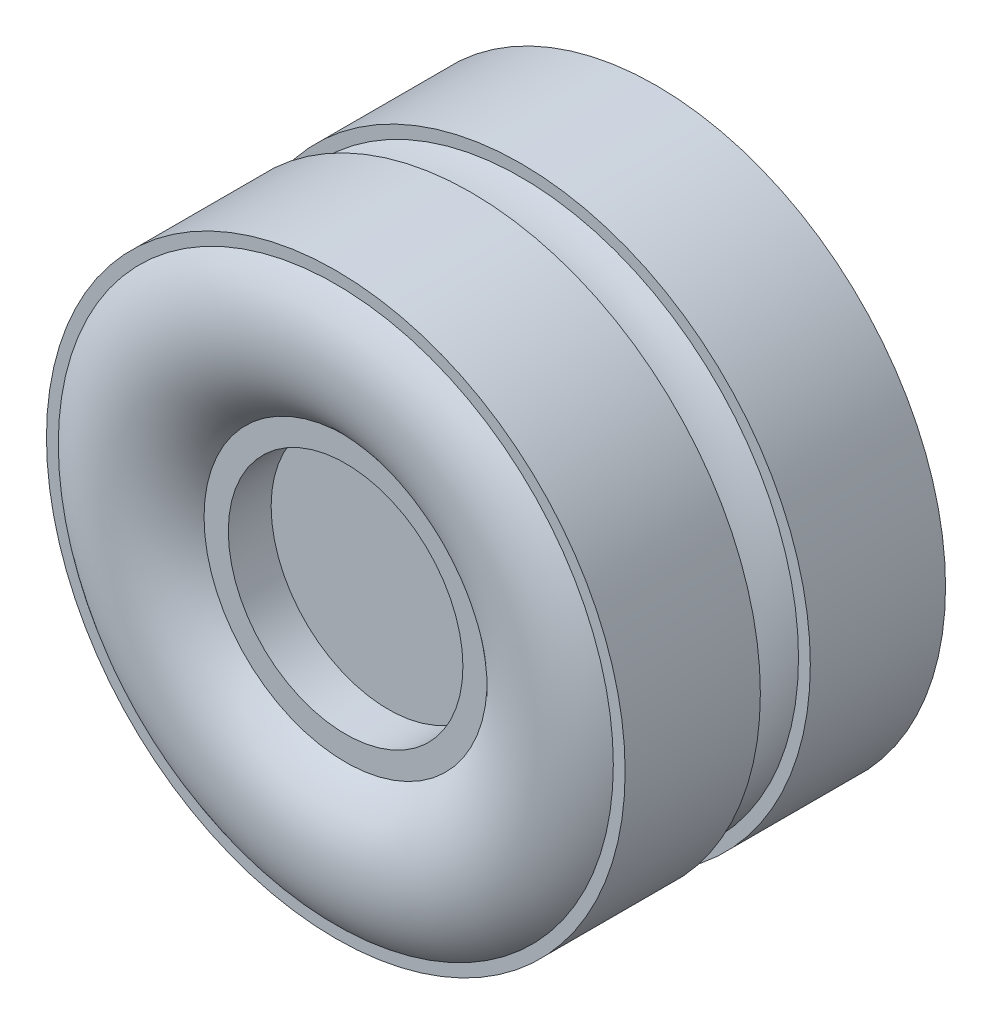
from build123d import *

# Parameters (mm, degrees)
LPATTERN1_COUNT = 2
LPATTERN1_PITCH = 81.28


with BuildPart() as part:
    # Sketch1 → Revolve1 (revolve)
    with BuildSketch(Plane(origin=(0, 0, 0), x_dir=(0, 0, -1), z_dir=(1, 0, 0)), mode=Mode.PRIVATE) as revolve1_sk:
        with BuildLine():
            Line((-25.371246969, 62.132957967), (-25.371246969, 51.488686035))
            Line((-25.371246969, 51.488686035), (-6.565437333, 51.488686035))
            Line((-6.565437333, 51.488686035), (-6.565437333, 0))
            Line((-6.565437333, 0), (6.938700483, 0))
            Line((6.938700483, 0), (6.938700483, 51.488686035))
            Line((6.938700483, 51.488686035), (25.371246969, 51.488686035))
            Line((25.371246969, 51.488686035), (25.371246969, 62.132957967))
            ThreePointArc((25.371246969, 62.132957967), (39.595184172, 91.101633012), (29.67355, 121.811007782))
            Line((29.67355, 121.811007782), (29.67355, 127))
            Line((29.67355, 127), (-29.67355, 127))
            Line((-29.67355, 127), (-29.67355, 121.811007782))
            ThreePointArc((-29.67355, 121.811007782), (-39.595184172, 91.101633012), (-25.371246969, 62.132957967))
        make_face()
    revolve(revolve1_sk.sketch.rotate(Axis((0, 0, 0), (0, 0, 1)), 90), axis=Axis((0, 0, 0), (0, 0, 1)))


with BuildPart() as lpattern1_1:
    # LPattern1: pattern copy
    add(part.part.moved(Location(Vector(0, 0, -1) * (1 * LPATTERN1_PITCH))))


solid = Compound([part.part, lpattern1_1.part])
